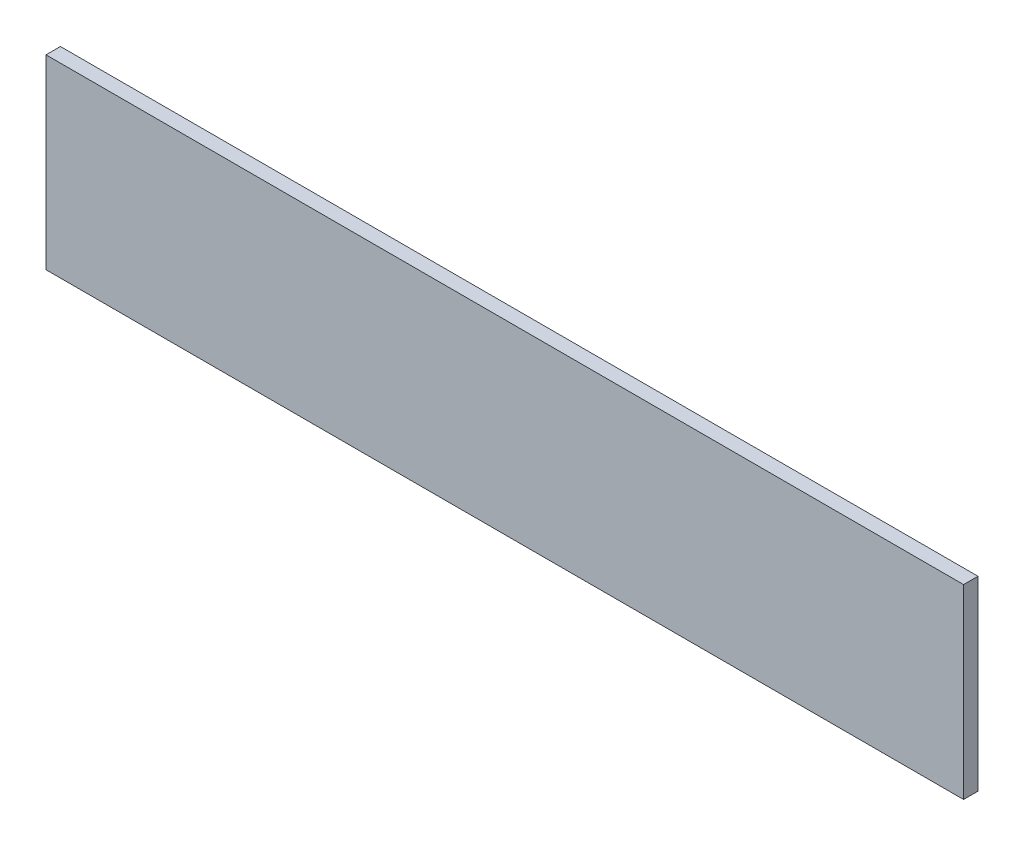
from build123d import *

# Parameters (mm, degrees)
CROQUIS1_W              = 350
CROQUIS1_H              = 71
SALIENTE_EXTRUIR1_DEPTH = 5.5


with BuildPart() as part:
    # Croquis1 → Saliente-Extruir1 (new body)
    with BuildSketch(Plane.XY):
        with Locations((75.36809816, 4.86809816)):
            Rectangle(CROQUIS1_W, CROQUIS1_H)
    extrude(amount=SALIENTE_EXTRUIR1_DEPTH)


solid = part.part
